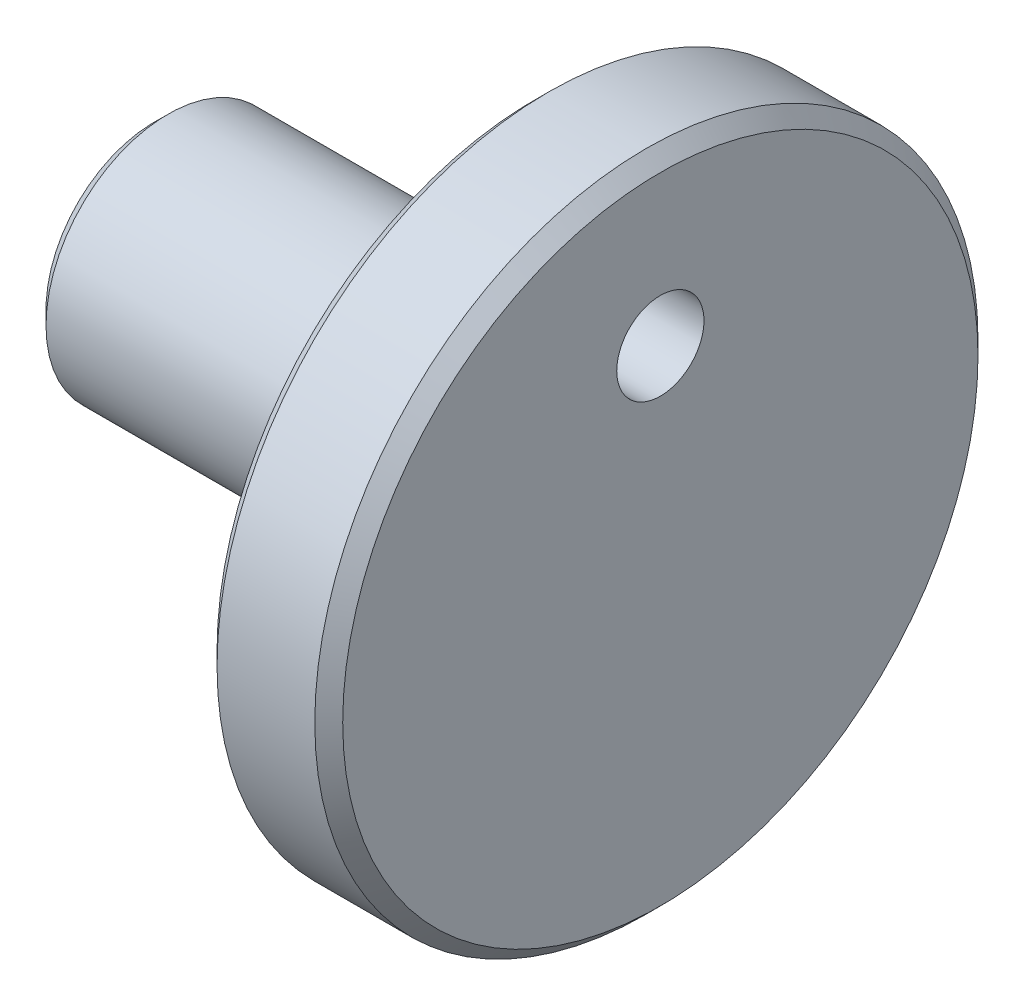
from build123d import *

# Parameters (mm, degrees)
SKETCH_3_R          = 1.25
CUT_EXTRUDE_1_DEPTH = 18.300578025
CHAMFER_1_SIZE      = 0.4


with BuildPart() as part:
    # Эскиз2 → Повернуть1 (revolve)
    with BuildSketch(Plane.XY, mode=Mode.PRIVATE) as revolve_1_sk:
        Polygon((0, 0), (0, 9.5), (-3.6, 9.5), (-3.6, 3.5), (-14.5, 3.5), (-14.5, 0), align=None)
    revolve(revolve_1_sk.sketch.rotate(Axis((-14.5, 0, 0), (1, 0, 0)), 90), axis=Axis((-14.5, 0, 0), (1, 0, 0)))

    # Эскиз3 → Вырез-Вытянуть1 (cut, through all)
    with BuildSketch(Plane.ZY.offset(3.6)):
        with Locations((0, 4.8)):
            Circle(SKETCH_3_R)
    extrude(amount=-CUT_EXTRUDE_1_DEPTH, mode=Mode.SUBTRACT)

    # Фаска1
    chamfer_1_edges = [part.edges().sort_by_distance(p)[0] for p in [
        (-14.5, 0, -3.5),
        (-3.6, 0, -9.5),
        (0, 0, -9.5),
    ]]
    chamfer(chamfer_1_edges, length=CHAMFER_1_SIZE)


solid = part.part
